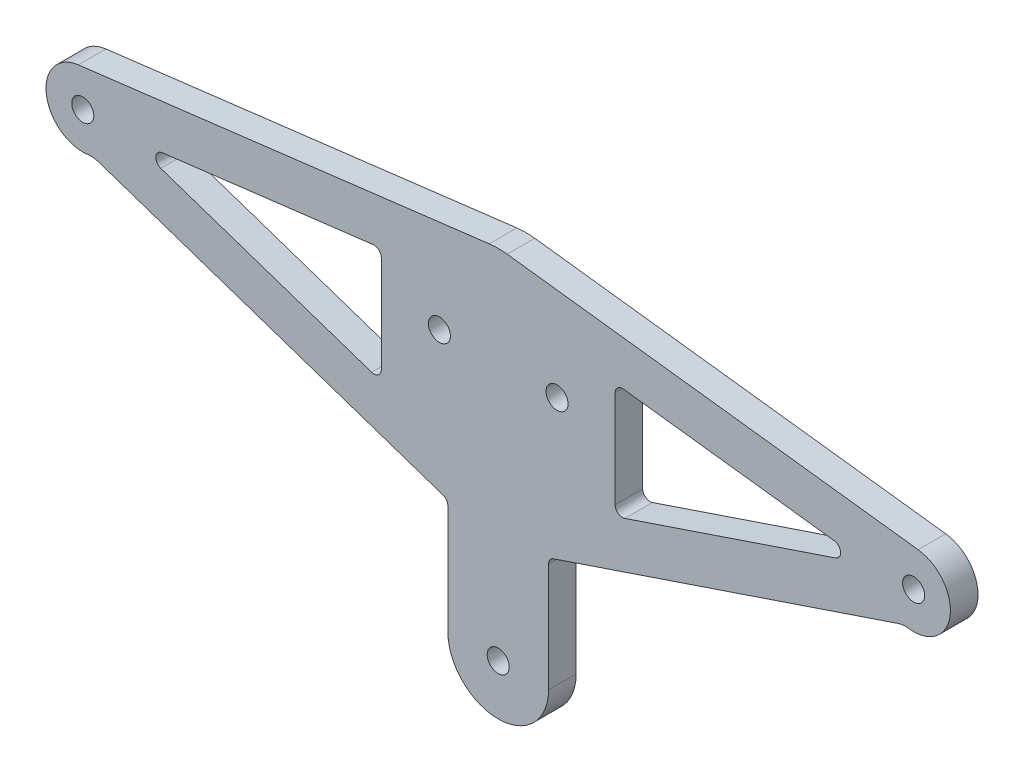
from build123d import *

# Parameters (mm, degrees)
ESBO_O1_R                = 1.5
RESSALTO_EXTRUS_O1_DEPTH = 3.75
FILETE2_R                = 10


with BuildPart() as part:
    # Esboço1 → Ressalto-extrusão1 (new body)
    with BuildSketch(Plane.XY):
        with BuildLine():
            Line((56.5, 11.974876818), (-0.609346717, 4.962730758))
            ThreePointArc((-0.609346717, 4.962730758), (-4.956620044, -0.657204491), (0.705001075, -4.950047827))
            ThreePointArc((0.705001075, -4.950047827), (1.403511249, -4.932754227), (2.087076087, -5.077511421))
            Line((2.087076087, -5.077511421), (48.969691456, -20.895588778))
            ThreePointArc((48.969691456, -20.895588778), (49.462308887, -21.259883017), (49.65, -21.843110478))
            Line((49.65, -21.843110478), (49.65, -36.675123182))
            ThreePointArc((49.65, -36.675123182), (56.5, -43.525123182), (63.35, -36.675123182))
            Line((63.35, -36.675123182), (63.35, -21.843110478))
            ThreePointArc((63.35, -21.843110478), (63.537691113, -21.259883017), (64.030308544, -20.895588778))
            Line((64.030308544, -20.895588778), (110.912923913, -5.077511421))
            ThreePointArc((110.912923913, -5.077511421), (111.596488751, -4.932754227), (112.294998925, -4.950047827))
            ThreePointArc((112.294998925, -4.950047827), (117.956620044, -0.657204491), (113.609346717, 4.962730758))
            Line((113.609346717, 4.962730758), (56.5, 11.974876818))
        make_face()
        Circle(ESBO_O1_R, mode=Mode.SUBTRACT)
        with Locations((113, 0)):
            Circle(ESBO_O1_R, mode=Mode.SUBTRACT)
        with Locations((48.5, -1.675123182)):
            Circle(ESBO_O1_R, mode=Mode.SUBTRACT)
        with Locations((64.5, -1.675123182)):
            Circle(ESBO_O1_R, mode=Mode.SUBTRACT)
        with Locations((56.5, -36.675123182)):
            Circle(ESBO_O1_R, mode=Mode.SUBTRACT)
        with BuildLine():
            Line((39.280308544, -11.294106381), (10.609409181, -1.620616529))
            ThreePointArc((10.609409181, -1.620616529), (9.93425904, -0.571654218), (10.807231293, 0.319451323))
            Line((10.807231293, 0.319451323), (39.478130657, 3.839795112))
            ThreePointArc((39.478130657, 3.839795112), (40.262620048, 3.596204682), (40.6, 2.847248961))
            Line((40.6, 2.847248961), (40.6, -10.346584681))
            ThreePointArc((40.6, -10.346584681), (40.183227462, -11.158893568), (39.280308544, -11.294106381))
        make_face(mode=Mode.SUBTRACT)
        with BuildLine():
            Line((73.719691456, -11.294106381), (102.390590819, -1.620616529))
            ThreePointArc((102.390590819, -1.620616529), (103.06574096, -0.571654218), (102.192768707, 0.319451323))
            Line((102.192768707, 0.319451323), (73.521869343, 3.839795112))
            ThreePointArc((73.521869343, 3.839795112), (72.737379952, 3.596204682), (72.4, 2.847248961))
            Line((72.4, 2.847248961), (72.4, -10.346584681))
            ThreePointArc((72.4, -10.346584681), (72.816772538, -11.158893568), (73.719691456, -11.294106381))
        make_face(mode=Mode.SUBTRACT)
    extrude(amount=RESSALTO_EXTRUS_O1_DEPTH)

    # Filete2
    filete2_edges = [part.edges().sort_by_distance(p)[0] for p in [
        (56.5, 11.974876818, 1.875),
    ]]
    fillet(filete2_edges, radius=FILETE2_R)


solid = part.part
